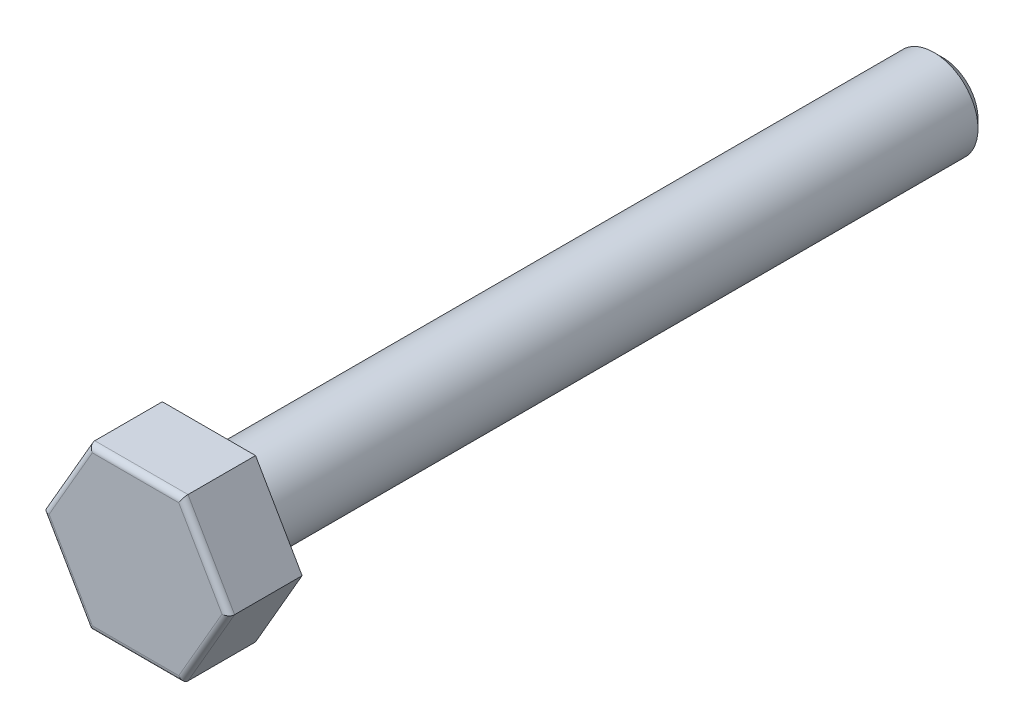
from build123d import *

# Parameters (mm, degrees)
BOSS_EXTRUDE1_DEPTH = 2.5
SKETCH2_R           = 1.5
BOSS_EXTRUDE2_DEPTH = 25
CHAMFER1_SIZE       = 0.3
FILLET1_R           = 0.2


with BuildPart() as part:
    # Sketch1 → Boss-Extrude1 (new body)
    with BuildSketch(Plane.XY):
        Polygon((3.175426481, 0), (1.58771324, 2.75), (-1.58771324, 2.75), (-3.175426481, 0), (-1.58771324, -2.75), (1.58771324, -2.75), align=None)
    extrude(amount=BOSS_EXTRUDE1_DEPTH)

    # Sketch2 → Boss-Extrude2 (add)
    with BuildSketch(Plane(origin=(0, 0, 0), x_dir=(-1, 0, 0), z_dir=(0, 0, -1))):
        with Locations(Location((0, 0, 0), (0, 0, 180))):
            Circle(SKETCH2_R)
    extrude(amount=BOSS_EXTRUDE2_DEPTH)

    # Chamfer1
    chamfer1_edges = [part.edges().sort_by_distance(p)[0] for p in [
        (-1.5, 0, -25),
    ]]
    chamfer(chamfer1_edges, length=CHAMFER1_SIZE)

    # Fillet1
    fillet1_edges = [part.edges().sort_by_distance(p)[0] for p in [
        (0, 2.75, 2.5),
        (-2.38156986, 1.375, 2.5),
        (-2.38156986, -1.375, 2.5),
        (0, -2.75, 2.5),
        (2.38156986, -1.375, 2.5),
        (2.38156986, 1.375, 2.5),
    ]]
    fillet(fillet1_edges, radius=FILLET1_R)


solid = part.part
